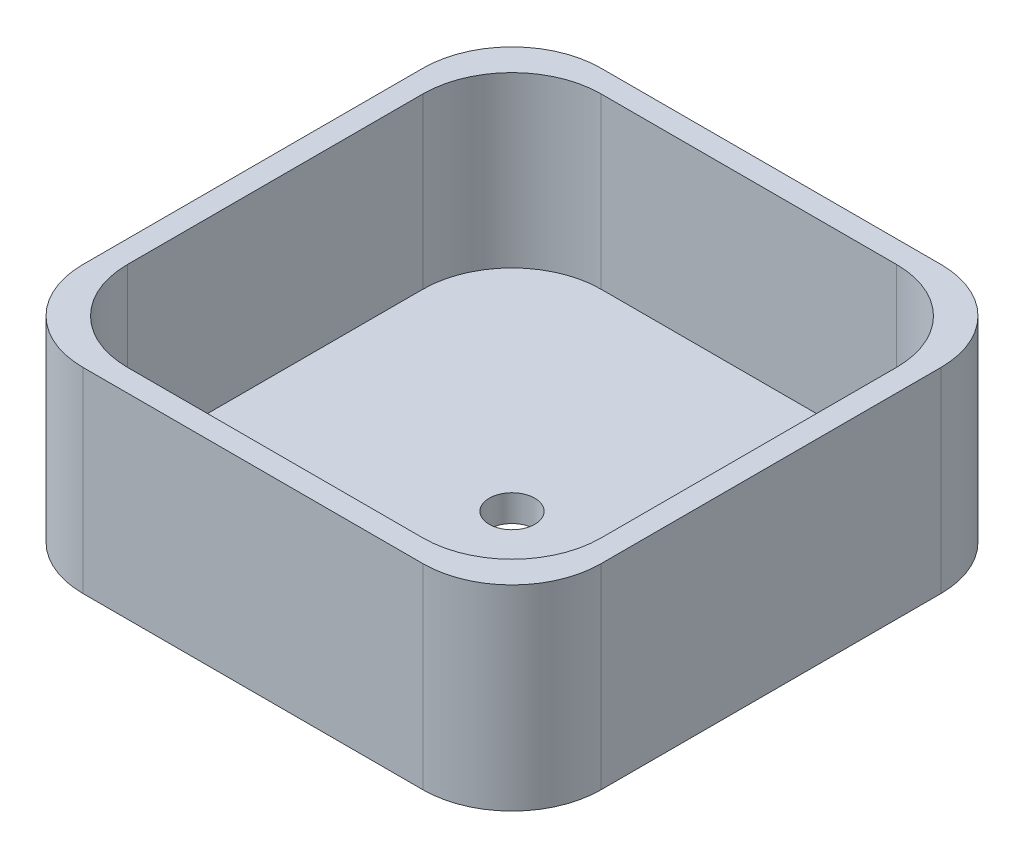
from build123d import *

# Parameters (mm, degrees)
SKETCH_1_W      = 58.2
SKETCH_1_H      = 58.2
SKETCH_1_W_2    = 53.2
SKETCH_1_H_2    = 53.2
EXTRUDE_1_DEPTH = 22
SKETCH_1_3_W    = 53.2
SKETCH_1_3_H    = 53.2
SKETCH_1_3_R    = 2.55
EXTRUDE_2_DEPTH = 3
FILLET_1_R      = 10


with BuildPart() as part:
    # 草图1 → 凸台-拉伸1 (new body)
    with BuildSketch(Plane(origin=(0, 0, 0), x_dir=(1, 0, 0), z_dir=(0, 1, 0))):
        Rectangle(SKETCH_1_W, SKETCH_1_H)
        Rectangle(SKETCH_1_W_2, SKETCH_1_H_2, mode=Mode.SUBTRACT)
    extrude(amount=EXTRUDE_1_DEPTH)

    # 草图1<3> → 凸台-拉伸2 (add)
    with BuildSketch(Plane(origin=(0, 0, 0), x_dir=(1, 0, 0), z_dir=(0, 1, 0))):
        Rectangle(SKETCH_1_3_W, SKETCH_1_3_H)
        Circle(SKETCH_1_3_R, mode=Mode.SUBTRACT)
    extrude(amount=EXTRUDE_2_DEPTH)

    # 圆角1
    fillet_1_edges = [part.edges().sort_by_distance(p)[0] for p in [
        (29.1, 11, 29.1),
        (26.6, 12.5, 26.6),
        (-26.6, 12.5, 26.6),
        (26.6, 12.5, -26.6),
        (-26.6, 12.5, -26.6),
        (29.1, 11, -29.1),
        (-29.1, 11, -29.1),
        (-29.1, 11, 29.1),
    ]]
    fillet(fillet_1_edges, radius=FILLET_1_R)


solid = part.part
